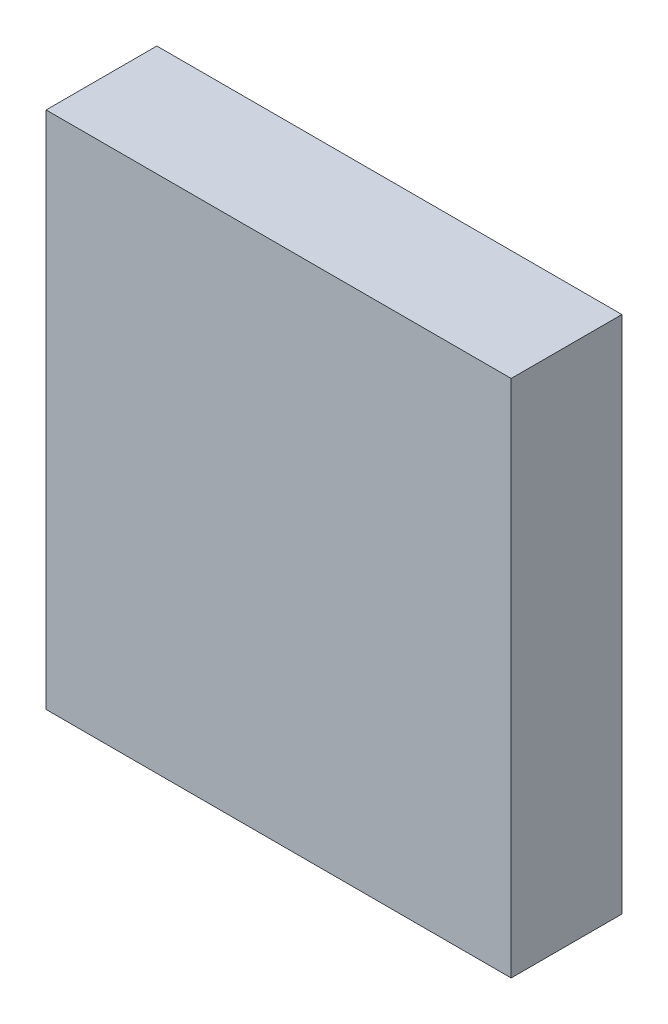
from build123d import *

# Parameters (mm, degrees)
SKETCH1_W           = 273
SKETCH1_H           = 304.8
BOSS_EXTRUDE1_DEPTH = 65


with BuildPart() as part:
    # Sketch1 → Boss-Extrude1 (new body)
    with BuildSketch(Plane.XY):
        with Locations((136.5, 152.4)):
            Rectangle(SKETCH1_W, SKETCH1_H)
    extrude(amount=BOSS_EXTRUDE1_DEPTH)


solid = part.part
